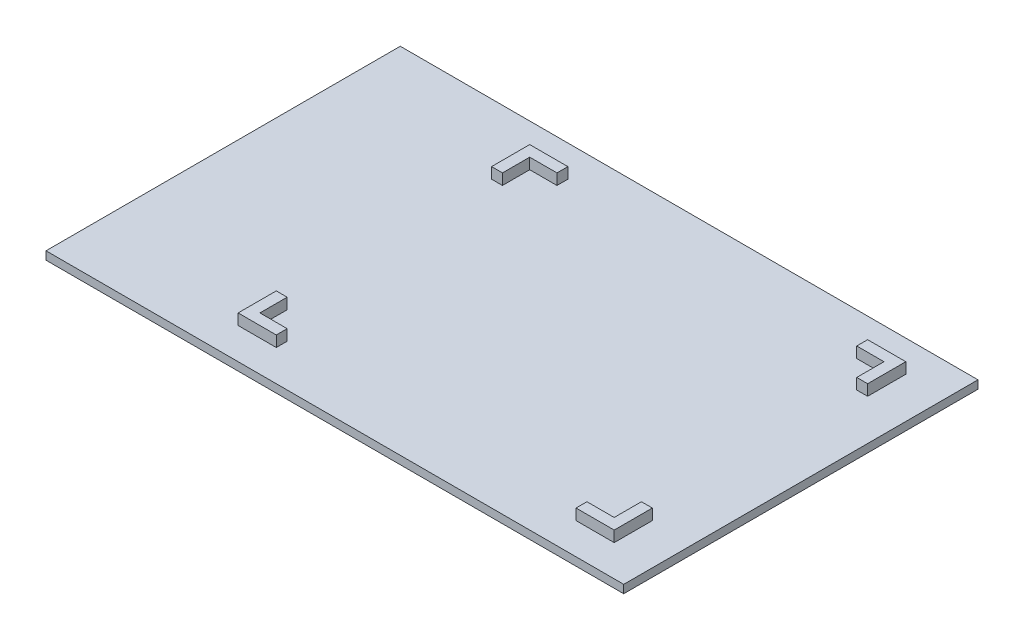
from build123d import *

# Parameters (mm, degrees)
SKETCH2_W           = 212
SKETCH2_H           = 130
BOSS_EXTRUDE1_DEPTH = 3
BOSS_EXTRUDE2_DEPTH = 4


with BuildPart() as part:
    # Sketch2 → Boss-Extrude1 (new body)
    with BuildSketch(Plane(origin=(0, 0, 0), x_dir=(1, 0, 0), z_dir=(0, 1, 0))):
        Rectangle(SKETCH2_W, SKETCH2_H)
    extrude(amount=BOSS_EXTRUDE1_DEPTH)

    # Sketch3 → Boss-Extrude2 (add)
    with BuildSketch(Plane(origin=(0, 3, 0), x_dir=(1, 0, 0), z_dir=(0, 1, 0))):
        Polygon((91, 53.5), (77, 53.5), (77, 49.5), (87, 49.5), (87, 39.5), (91, 39.5), align=None)
        Polygon((91, -39.5), (91, -53.5), (77, -53.5), (77, -49.5), (87, -49.5), (87, -39.5), align=None)
        Polygon((-43, -49.5), (-43, -39.5), (-47, -39.5), (-47, -53.5), (-33, -53.5), (-33, -49.5), align=None)
        Polygon((-43, 39.5), (-47, 39.5), (-47, 53.5), (-33, 53.5), (-33, 49.5), (-43, 49.5), align=None)
    extrude(amount=BOSS_EXTRUDE2_DEPTH)


solid = part.part
